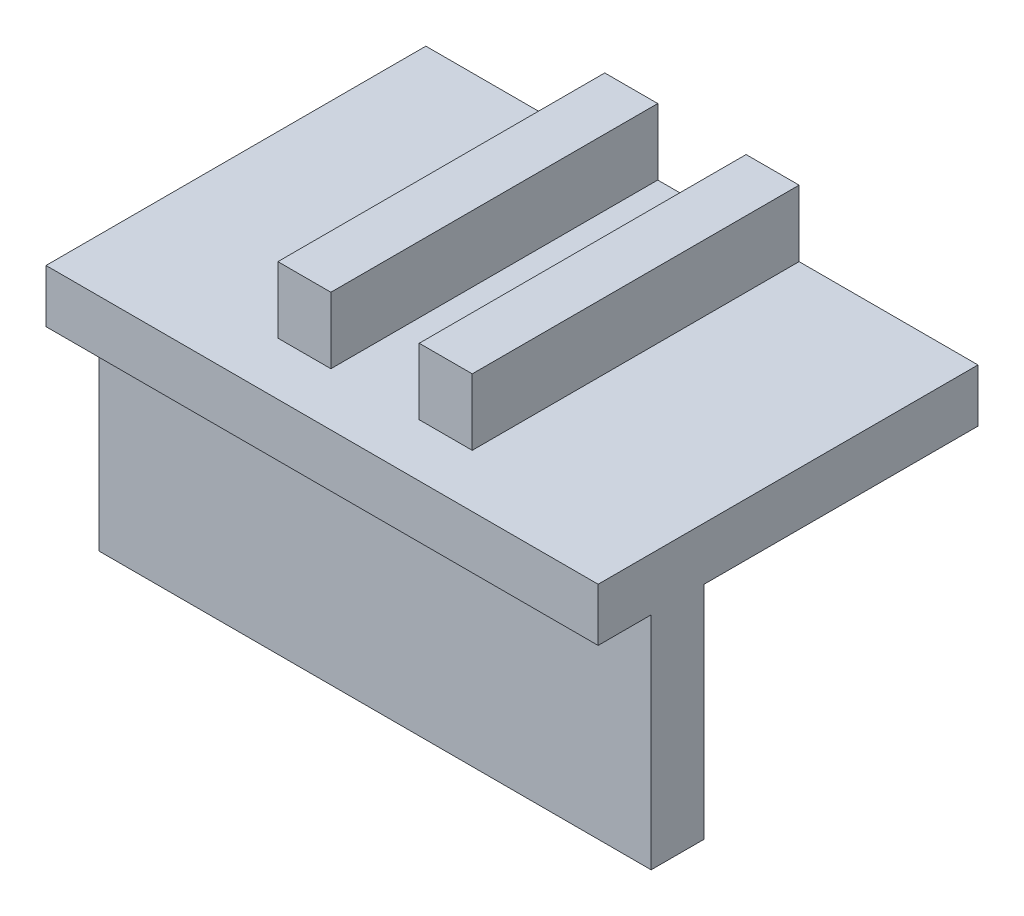
from build123d import *

# Parameters (mm, degrees)
SKETCH1_W           = 125
SKETCH1_H           = 62
BOSS_EXTRUDE2_DEPTH = 12
SKETCH3_W           = 125
SKETCH3_H           = 62
BOSS_EXTRUDE3_DEPTH = 12
SKETCH4_W           = 12
SKETCH4_H           = 74
BOSS_EXTRUDE4_DEPTH = 15
SKETCH5_W           = 125
SKETCH5_H           = 12
BOSS_EXTRUDE5_DEPTH = 12


with BuildPart() as part:
    # Sketch1 → Boss-Extrude2 (new body)
    with BuildSketch(Plane.XY):
        with Locations((62.5, 31)):
            Rectangle(SKETCH1_W, SKETCH1_H)
    extrude(amount=BOSS_EXTRUDE2_DEPTH)

    # Sketch3 → Boss-Extrude3 (add)
    with BuildSketch(Plane(origin=(0, 62, 0), x_dir=(1, 0, 0), z_dir=(0, 1, 0))):
        with Locations((62.5, 31)):
            Rectangle(SKETCH3_W, SKETCH3_H)
    extrude(amount=-BOSS_EXTRUDE3_DEPTH)

    # Sketch4 → Boss-Extrude4 (add)
    with BuildSketch(Plane(origin=(0, 62, 0), x_dir=(1, 0, 0), z_dir=(0, 1, 0))):
        with Locations((46.5, 25)):
            Rectangle(SKETCH4_W, SKETCH4_H)
        with Locations((78.5, 25)):
            Rectangle(SKETCH4_W, SKETCH4_H)
    extrude(amount=BOSS_EXTRUDE4_DEPTH)

    # Sketch5 → Boss-Extrude5 (add)
    with BuildSketch(Plane.XY.offset(12)):
        with Locations((62.5, 56)):
            Rectangle(SKETCH5_W, SKETCH5_H)
    extrude(amount=BOSS_EXTRUDE5_DEPTH)


solid = part.part
